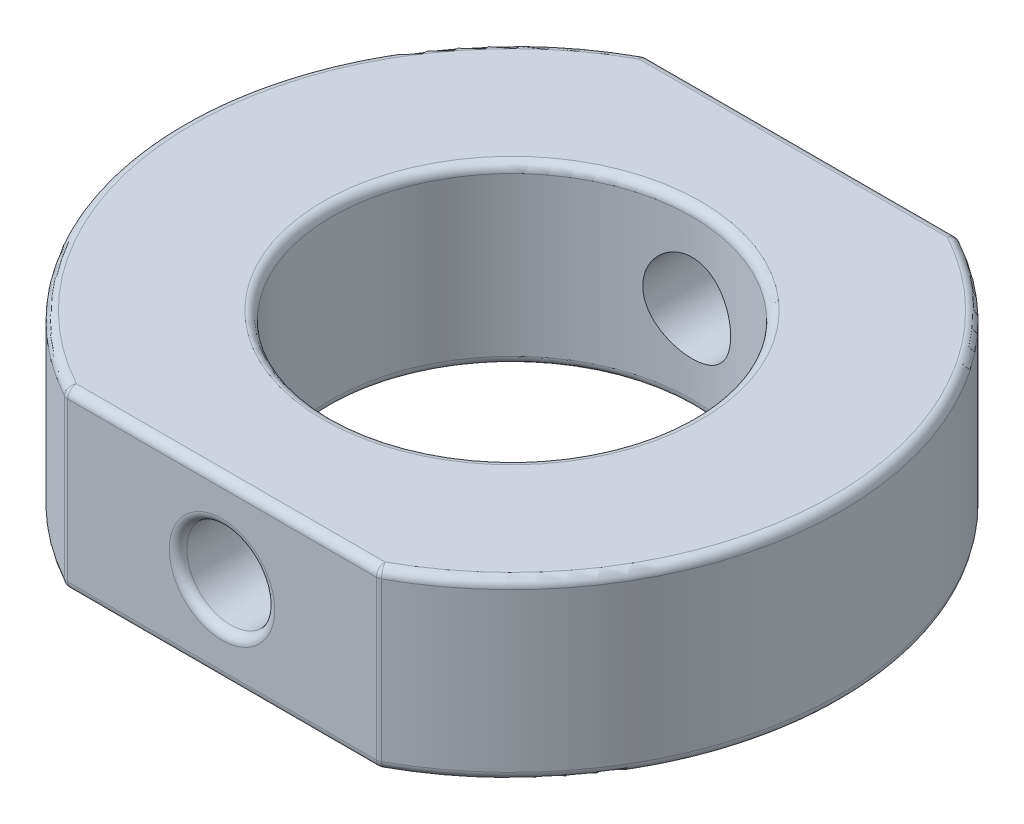
from build123d import *

# Parameters (mm, degrees)
EXTRUDE_1_DEPTH          = 2
EXTRUDE_1_DEPTH_BACK     = 2
SKETCH_1_R               = 7.5
SKETCH_1_R_2             = 4.1
CUT_EXTRUDE_1_DEPTH      = 11.793516572
CUT_EXTRUDE_1_DEPTH_BACK = 11.793516572
SKETCH_2_R               = 1
SKETCH_3_W               = 25.706722618
SKETCH_3_H               = 2.806509832
CUT_EXTRUDE_2_DEPTH      = 12.335784227
FILLET_1_R               = 0.2


with BuildPart() as part:
    # 草图1 → 凸台-拉伸1 (new, two sides: drawn at the far end of the back side and taken through both)
    with BuildSketch(Plane(origin=(0, 0, 0), x_dir=(1, 0, 0), z_dir=(0, 1, 0)).offset(-EXTRUDE_1_DEPTH_BACK)):
        Circle(SKETCH_1_R)
        Circle(SKETCH_1_R_2, mode=Mode.SUBTRACT)
    extrude(amount=EXTRUDE_1_DEPTH + EXTRUDE_1_DEPTH_BACK)

    # 草图2 → 切除-拉伸1 (cut, two sides: drawn at the far end of the back side and taken through both)
    with BuildSketch(Plane.XY.offset(-CUT_EXTRUDE_1_DEPTH_BACK)):
        Circle(SKETCH_2_R)
    extrude(amount=CUT_EXTRUDE_1_DEPTH + CUT_EXTRUDE_1_DEPTH_BACK, mode=Mode.SUBTRACT)

    # 草图3 → 切除-拉伸2 (cut, through all)
    with BuildSketch(Plane(origin=(0, 2, 0), x_dir=(1, 0, 0), z_dir=(0, 1, 0))):
        with Locations((0, 8.003254916)):
            Rectangle(SKETCH_3_W, SKETCH_3_H)
        with Locations((0, -8.003254916)):
            Rectangle(SKETCH_3_W, SKETCH_3_H)
    extrude(amount=-CUT_EXTRUDE_2_DEPTH, mode=Mode.SUBTRACT)

    # 圆角1
    fillet_1_edges = [part.edges().sort_by_distance(p)[0] for p in [
        (-4.1, 2, 0),
        (-4.1, -2, 0),
        (7.5, 2, 0),
        (0, 2, 6.6),
        (-7.5, 2, 0),
        (0, 2, -6.6),
        (0, -2, 6.6),
        (7.5, -2, 0),
        (0, -2, -6.6),
        (-7.5, -2, 0),
        (-1, 0, 6.6),
        (3.562302626, 0, 6.6),
        (-3.562302626, 0, 6.6),
        (-1, 0, -6.6),
        (-3.562302626, 0, -6.6),
        (3.562302626, 0, -6.6),
    ]]
    fillet(fillet_1_edges, radius=FILLET_1_R)


solid = part.part
